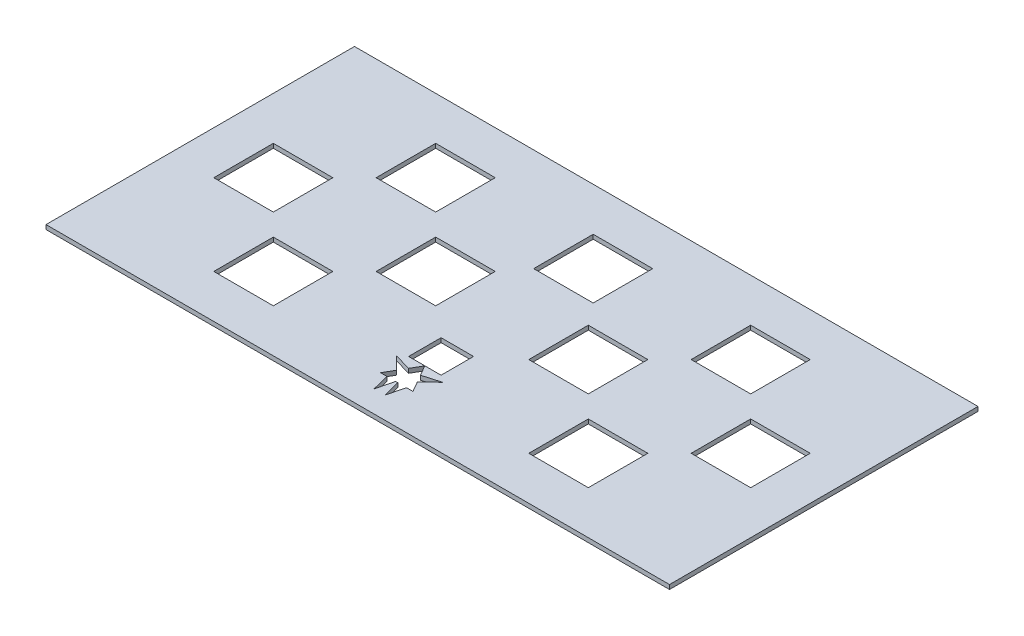
from build123d import *

# Parameters (mm, degrees)
SKETCH1_W           = 144
SKETCH1_H           = 71.25
BOSS_EXTRUDE1_DEPTH = 1
SKETCH2_W           = 13.75
SKETCH2_H           = 13.75
CUT_EXTRUDE1_DEPTH  = 81.33766629
SKETCH3_W           = 13.75
SKETCH3_H           = 13.75
CUT_EXTRUDE2_DEPTH  = 81.33766629
SKETCH4_W           = 7.5
SKETCH4_H           = 7.5
CUT_EXTRUDE6_DEPTH  = 81.33766629


with BuildPart() as part:
    # Sketch1 → Boss-Extrude1 (new body)
    with BuildSketch(Plane(origin=(0, 0, 0), x_dir=(1, 0, 0), z_dir=(0, 1, 0))):
        Rectangle(SKETCH1_W, SKETCH1_H)
    extrude(amount=BOSS_EXTRUDE1_DEPTH)

    # Sketch2 → Cut-Extrude1 (cut, through all)
    with BuildSketch(Plane(origin=(0, 1, 0), x_dir=(1, 0, 0), z_dir=(0, 1, 0))):
        with Locations((-36.375, 18.75)):
            Rectangle(SKETCH2_W, SKETCH2_H)
        with Locations((-55.125, 0)):
            Rectangle(SKETCH2_W, SKETCH2_H)
        with Locations((-36.375, -18.75)):
            Rectangle(SKETCH2_W, SKETCH2_H)
        with Locations((-17.625, 0)):
            Rectangle(SKETCH2_W, SKETCH2_H)
    cut_extrude1 = extrude(amount=-CUT_EXTRUDE1_DEPTH, mode=Mode.SUBTRACT)

    # Mirror1: Cut-Extrude1 across plane
    add(cut_extrude1.mirror(Plane(origin=(0, 0, 0), x_dir=(0, 0, 1), z_dir=(1, 0, 0))), mode=Mode.SUBTRACT)

    # Sketch3 → Cut-Extrude2 (cut, through all)
    with BuildSketch(Plane(origin=(0, 1, 0), x_dir=(1, 0, 0), z_dir=(0, 1, 0))):
        with Locations((0, 18.75)):
            Rectangle(SKETCH3_W, SKETCH3_H)
    extrude(amount=-CUT_EXTRUDE2_DEPTH, mode=Mode.SUBTRACT)

    # Sketch4 → Cut-Extrude6 (cut, through all)
    with BuildSketch(Plane(origin=(0, 1, 0), x_dir=(1, 0, 0), z_dir=(0, 1, 0))):
        with Locations((0, -16.379809472)):
            Rectangle(SKETCH4_W, SKETCH4_H)
        Polygon((0.05, -20.216412012), (-0.05, -20.216412012), (-1.375, -22.511379332), (-2.375, -24.24343014), (-3.75, -26.625), (-2.25, -26.625), (-0.25, -26.625), (0.25, -26.625), (2.25, -26.625), (3.75, -26.625), (2.375, -24.24343014), (1.375, -22.511379332), align=None)
        Polygon((5.339101615, -21.377404736), (1.375, -22.511379332), (2.375, -24.24343014), align=None)
        Polygon((-2.375, -24.24343014), (-1.375, -22.511379332), (-5.339101615, -21.377404736), align=None)
        Polygon((-0.25, -26.625), (-2.25, -26.625), (-1.25, -30.625), align=None)
        Polygon((1.25, -30.625), (2.25, -26.625), (0.25, -26.625), align=None)
        Polygon((-0.05, -20.216412012), (0, -20.129809472), (-0.05, -20.129809472), align=None)
        Polygon((0.05, -20.129809472), (0, -20.129809472), (0.05, -20.216412012), align=None)
        Polygon((0.05, -20.216412012), (0, -20.129809472), (-0.05, -20.216412012), align=None)
    extrude(amount=-CUT_EXTRUDE6_DEPTH, mode=Mode.SUBTRACT)


solid = part.part
